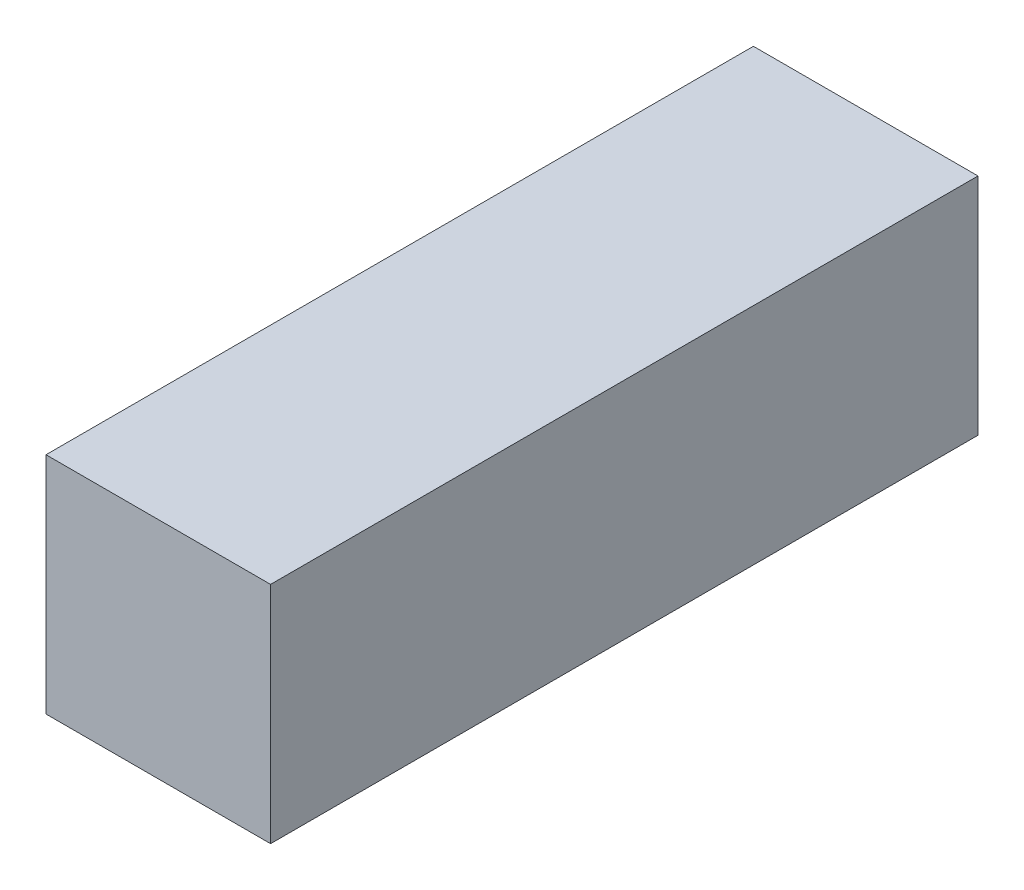
from build123d import *

# Parameters (mm, degrees)
SKETCH_1_W      = 10.16
SKETCH_1_H      = 10.16
EXTRUDE_1_DEPTH = 32.004


with BuildPart() as part:
    # 草图1 → 凸台-拉伸1 (new body)
    with BuildSketch(Plane.XY):
        with Locations((5.08, 5.08)):
            Rectangle(SKETCH_1_W, SKETCH_1_H)
    extrude(amount=EXTRUDE_1_DEPTH)


solid = part.part
